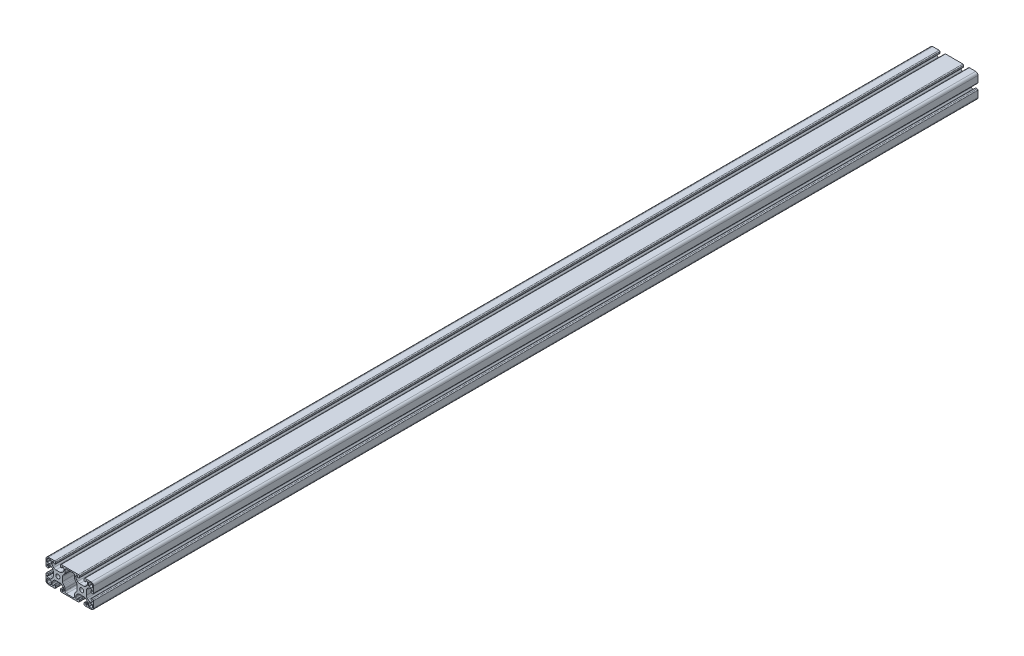
from build123d import *

# Parameters (mm, degrees)
ESQUISSE1_R        = 3.4
BOSS_EXTRU_1_DEPTH = 1487


with BuildPart() as part:
    # Esquisse1 → Boss.-Extru.1 (new body)
    with BuildSketch(Plane.XY.offset(20)):
        with BuildLine():
            Line((66.5, 4.5), (65, 4.5))
            ThreePointArc((65, 4.5), (64.292893219, 4.207106781), (64, 3.5))
            Line((64, 3.5), (64, 1.5))
            ThreePointArc((64, 1.5), (64.439339828, 0.439339828), (65.5, 0))
            Line((65.5, 0), (76, 0))
            ThreePointArc((76, 0), (78.828427125, 1.171572875), (80, 4))
            Line((80, 4), (80, 14.5))
            ThreePointArc((80, 14.5), (79.560660172, 15.560660172), (78.5, 16))
            Line((78.5, 16), (76.5, 16))
            ThreePointArc((76.5, 16), (75.792893219, 15.707106781), (75.5, 15))
            Line((75.5, 15), (75.5, 13.5))
            ThreePointArc((75.5, 13.5), (75.646446609, 13.146446609), (76, 13))
            Line((76, 13), (77.5, 13))
            ThreePointArc((77.5, 13), (77.853553391, 12.853553391), (78, 12.5))
            ThreePointArc((78, 12.5), (77.267766953, 10.732233047), (75.5, 10))
            Line((75.5, 10), (74.192388155, 10))
            ThreePointArc((74.192388155, 10), (72.278970994, 10.380602337), (70.656854249, 11.464466094))
            Line((70.656854249, 11.464466094), (69.214466094, 12.906854249))
            ThreePointArc((69.214466094, 12.906854249), (68.130602337, 14.528970994), (67.75, 16.442388155))
            Line((67.75, 16.442388155), (67.75, 23.557611845))
            ThreePointArc((67.75, 23.557611845), (68.130602337, 25.471029006), (69.214466094, 27.093145751))
            Line((69.214466094, 27.093145751), (70.656854249, 28.535533906))
            ThreePointArc((70.656854249, 28.535533906), (72.278970994, 29.619397663), (74.192388155, 30))
            Line((74.192388155, 30), (75.5, 30))
            ThreePointArc((75.5, 30), (77.267766953, 29.267766953), (78, 27.5))
            ThreePointArc((78, 27.5), (77.853553391, 27.146446609), (77.5, 27))
            Line((77.5, 27), (76, 27))
            ThreePointArc((76, 27), (75.646446609, 26.853553391), (75.5, 26.5))
            Line((75.5, 26.5), (75.5, 25))
            ThreePointArc((75.5, 25), (75.792893219, 24.292893219), (76.5, 24))
            Line((76.5, 24), (78.5, 24))
            ThreePointArc((78.5, 24), (79.560660172, 24.439339828), (80, 25.5))
            Line((80, 25.5), (80, 36))
            ThreePointArc((80, 36), (78.828427125, 38.828427125), (76, 40))
            Line((76, 40), (65.5, 40))
            ThreePointArc((65.5, 40), (64.439339828, 39.560660172), (64, 38.5))
            Line((64, 38.5), (64, 36.5))
            ThreePointArc((64, 36.5), (64.292893219, 35.792893219), (65, 35.5))
            Line((65, 35.5), (66.5, 35.5))
            ThreePointArc((66.5, 35.5), (66.853553391, 35.646446609), (67, 36))
            Line((67, 36), (67, 37.5))
            ThreePointArc((67, 37.5), (67.146446609, 37.853553391), (67.5, 38))
            ThreePointArc((67.5, 38), (69.267766953, 37.267766953), (70, 35.5))
            Line((70, 35.5), (70, 34.192388155))
            ThreePointArc((70, 34.192388155), (69.619397663, 32.278970994), (68.535533906, 30.656854249))
            Line((68.535533906, 30.656854249), (67.093145751, 29.214466094))
            ThreePointArc((67.093145751, 29.214466094), (65.471029006, 28.130602337), (63.557611845, 27.75))
            Line((63.557611845, 27.75), (56.442388155, 27.75))
            ThreePointArc((56.442388155, 27.75), (54.528970994, 28.130602337), (52.906854249, 29.214466094))
            Line((52.906854249, 29.214466094), (51.464466094, 30.656854249))
            ThreePointArc((51.464466094, 30.656854249), (50.380602337, 32.278970994), (50, 34.192388155))
            Line((50, 34.192388155), (50, 35.5))
            ThreePointArc((50, 35.5), (50.732233047, 37.267766953), (52.5, 38))
            ThreePointArc((52.5, 38), (52.853553391, 37.853553391), (53, 37.5))
            Line((53, 37.5), (53, 36))
            ThreePointArc((53, 36), (53.146446609, 35.646446609), (53.5, 35.5))
            Line((53.5, 35.5), (55, 35.5))
            ThreePointArc((55, 35.5), (55.707106781, 35.792893219), (56, 36.5))
            Line((56, 36.5), (56, 38.5))
            ThreePointArc((56, 38.5), (55.560660172, 39.560660172), (54.5, 40))
            Line((54.5, 40), (25.5, 40))
            ThreePointArc((25.5, 40), (24.439339828, 39.560660172), (24, 38.5))
            Line((24, 38.5), (24, 36.5))
            ThreePointArc((24, 36.5), (24.292893219, 35.792893219), (25, 35.5))
            Line((25, 35.5), (26.5, 35.5))
            ThreePointArc((26.5, 35.5), (26.853553391, 35.646446609), (27, 36))
            Line((27, 36), (27, 37.5))
            ThreePointArc((27, 37.5), (27.146446609, 37.853553391), (27.5, 38))
            ThreePointArc((27.5, 38), (29.267766953, 37.267766953), (30, 35.5))
            Line((30, 35.5), (30, 34.192388155))
            ThreePointArc((30, 34.192388155), (29.619397663, 32.278970994), (28.535533906, 30.656854249))
            Line((28.535533906, 30.656854249), (27.093145751, 29.214466094))
            ThreePointArc((27.093145751, 29.214466094), (25.471029006, 28.130602337), (23.557611845, 27.75))
            Line((23.557611845, 27.75), (16.442388155, 27.75))
            ThreePointArc((16.442388155, 27.75), (14.528970994, 28.130602337), (12.906854249, 29.214466094))
            Line((12.906854249, 29.214466094), (11.464466094, 30.656854249))
            ThreePointArc((11.464466094, 30.656854249), (10.380602337, 32.278970994), (10, 34.192388155))
            Line((10, 34.192388155), (10, 35.5))
            ThreePointArc((10, 35.5), (10.732233047, 37.267766953), (12.5, 38))
            ThreePointArc((12.5, 38), (12.853553391, 37.853553391), (13, 37.5))
            Line((13, 37.5), (13, 36))
            ThreePointArc((13, 36), (13.146446609, 35.646446609), (13.5, 35.5))
            Line((13.5, 35.5), (15, 35.5))
            ThreePointArc((15, 35.5), (15.707106781, 35.792893219), (16, 36.5))
            Line((16, 36.5), (16, 38.5))
            ThreePointArc((16, 38.5), (15.560660172, 39.560660172), (14.5, 40))
            Line((14.5, 40), (4, 40))
            ThreePointArc((4, 40), (1.171572875, 38.828427125), (0, 36))
            Line((0, 36), (0, 25.5))
            ThreePointArc((0, 25.5), (0.439339828, 24.439339828), (1.5, 24))
            Line((1.5, 24), (3.5, 24))
            ThreePointArc((3.5, 24), (4.207106781, 24.292893219), (4.5, 25))
            Line((4.5, 25), (4.5, 26.5))
            ThreePointArc((4.5, 26.5), (4.353553391, 26.853553391), (4, 27))
            Line((4, 27), (2.5, 27))
            ThreePointArc((2.5, 27), (2.146446609, 27.146446609), (2, 27.5))
            ThreePointArc((2, 27.5), (2.732233047, 29.267766953), (4.5, 30))
            Line((4.5, 30), (5.807611845, 30))
            ThreePointArc((5.807611845, 30), (7.721029006, 29.619397663), (9.343145751, 28.535533906))
            Line((9.343145751, 28.535533906), (10.785533906, 27.093145751))
            ThreePointArc((10.785533906, 27.093145751), (11.869397663, 25.471029006), (12.25, 23.557611845))
            Line((12.25, 23.557611845), (12.25, 16.442388155))
            ThreePointArc((12.25, 16.442388155), (11.869397663, 14.528970994), (10.785533906, 12.906854249))
            Line((10.785533906, 12.906854249), (9.343145751, 11.464466094))
            ThreePointArc((9.343145751, 11.464466094), (7.721029006, 10.380602337), (5.807611845, 10))
            Line((5.807611845, 10), (4.5, 10))
            ThreePointArc((4.5, 10), (2.732233047, 10.732233047), (2, 12.5))
            ThreePointArc((2, 12.5), (2.146446609, 12.853553391), (2.5, 13))
            Line((2.5, 13), (4, 13))
            ThreePointArc((4, 13), (4.353553391, 13.146446609), (4.5, 13.5))
            Line((4.5, 13.5), (4.5, 15))
            ThreePointArc((4.5, 15), (4.207106781, 15.707106781), (3.5, 16))
            Line((3.5, 16), (1.5, 16))
            ThreePointArc((1.5, 16), (0.439339828, 15.560660172), (0, 14.5))
            Line((0, 14.5), (0, 4))
            ThreePointArc((0, 4), (1.171572875, 1.171572875), (4, 0))
            Line((4, 0), (14.5, 0))
            ThreePointArc((14.5, 0), (15.560660172, 0.439339828), (16, 1.5))
            Line((16, 1.5), (16, 3.5))
            ThreePointArc((16, 3.5), (15.707106781, 4.207106781), (15, 4.5))
            Line((15, 4.5), (13.5, 4.5))
            ThreePointArc((13.5, 4.5), (13.146446609, 4.353553391), (13, 4))
            Line((13, 4), (13, 2.5))
            ThreePointArc((13, 2.5), (12.853553391, 2.146446609), (12.5, 2))
            ThreePointArc((12.5, 2), (10.732233047, 2.732233047), (10, 4.5))
            Line((10, 4.5), (10, 5.807611845))
            ThreePointArc((10, 5.807611845), (10.380602337, 7.721029006), (11.464466094, 9.343145751))
            Line((11.464466094, 9.343145751), (12.906854249, 10.785533906))
            ThreePointArc((12.906854249, 10.785533906), (14.528970994, 11.869397663), (16.442388155, 12.25))
            Line((16.442388155, 12.25), (23.557611845, 12.25))
            ThreePointArc((23.557611845, 12.25), (25.471029006, 11.869397663), (27.093145751, 10.785533906))
            Line((27.093145751, 10.785533906), (28.535533906, 9.343145751))
            ThreePointArc((28.535533906, 9.343145751), (29.619397663, 7.721029006), (30, 5.807611845))
            Line((30, 5.807611845), (30, 4.5))
            ThreePointArc((30, 4.5), (29.267766953, 2.732233047), (27.5, 2))
            ThreePointArc((27.5, 2), (27.146446609, 2.146446609), (27, 2.5))
            Line((27, 2.5), (27, 4))
            ThreePointArc((27, 4), (26.853553391, 4.353553391), (26.5, 4.5))
            Line((26.5, 4.5), (25, 4.5))
            ThreePointArc((25, 4.5), (24.292893219, 4.207106781), (24, 3.5))
            Line((24, 3.5), (24, 1.5))
            ThreePointArc((24, 1.5), (24.439339828, 0.439339828), (25.5, 0))
            Line((25.5, 0), (54.5, 0))
            ThreePointArc((54.5, 0), (55.560660172, 0.439339828), (56, 1.5))
            Line((56, 1.5), (56, 3.5))
            ThreePointArc((56, 3.5), (55.707106781, 4.207106781), (55, 4.5))
            Line((55, 4.5), (53.5, 4.5))
            ThreePointArc((53.5, 4.5), (53.146446609, 4.353553391), (53, 4))
            Line((53, 4), (53, 2.5))
            ThreePointArc((53, 2.5), (52.853553391, 2.146446609), (52.5, 2))
            ThreePointArc((52.5, 2), (50.732233047, 2.732233047), (50, 4.5))
            Line((50, 4.5), (50, 5.807611845))
            ThreePointArc((50, 5.807611845), (50.380602337, 7.721029006), (51.464466094, 9.343145751))
            Line((51.464466094, 9.343145751), (52.906854249, 10.785533906))
            ThreePointArc((52.906854249, 10.785533906), (54.528970994, 11.869397663), (56.442388155, 12.25))
            Line((56.442388155, 12.25), (63.557611845, 12.25))
            ThreePointArc((63.557611845, 12.25), (65.471029006, 11.869397663), (67.093145751, 10.785533906))
            Line((67.093145751, 10.785533906), (68.535533906, 9.343145751))
            ThreePointArc((68.535533906, 9.343145751), (69.619397663, 7.721029006), (70, 5.807611845))
            Line((70, 5.807611845), (70, 4.5))
            ThreePointArc((70, 4.5), (69.267766953, 2.732233047), (67.5, 2))
            ThreePointArc((67.5, 2), (67.146446609, 2.146446609), (67, 2.5))
            Line((67, 2.5), (67, 4))
            ThreePointArc((67, 4), (66.853553391, 4.353553391), (66.5, 4.5))
        make_face()
        with Locations(Location((20, 20, 0), (0, 0, 180))):
            Circle(ESQUISSE1_R, mode=Mode.SUBTRACT)
        with Locations(Location((60, 20, 0), (0, 0, 180))):
            Circle(ESQUISSE1_R, mode=Mode.SUBTRACT)
        with BuildLine():
            Line((31.8, 4.5), (31.8, 8.250252532))
            ThreePointArc((31.8, 8.250252532), (31.419397663, 10.163669694), (30.335533906, 11.785786438))
            Line((30.335533906, 11.785786438), (29.214466094, 12.906854249))
            ThreePointArc((29.214466094, 12.906854249), (28.130602337, 14.528970994), (27.75, 16.442388155))
            Line((27.75, 16.442388155), (27.75, 23.557611845))
            ThreePointArc((27.75, 23.557611845), (28.130602337, 25.471029006), (29.214466094, 27.093145751))
            Line((29.214466094, 27.093145751), (30.335533906, 28.214213562))
            ThreePointArc((30.335533906, 28.214213562), (31.419397663, 29.836330306), (31.8, 31.749747468))
            Line((31.8, 31.749747468), (31.8, 35.5))
            ThreePointArc((31.8, 35.5), (32.532233047, 37.267766953), (34.3, 38))
            Line((34.3, 38), (45.7, 38))
            ThreePointArc((45.7, 38), (47.467766953, 37.267766953), (48.2, 35.5))
            Line((48.2, 35.5), (48.2, 31.749747468))
            ThreePointArc((48.2, 31.749747468), (48.580602337, 29.836330306), (49.664466094, 28.214213562))
            Line((49.664466094, 28.214213562), (50.785533906, 27.093145751))
            ThreePointArc((50.785533906, 27.093145751), (51.869397663, 25.471029006), (52.25, 23.557611845))
            Line((52.25, 23.557611845), (52.25, 16.442388155))
            ThreePointArc((52.25, 16.442388155), (51.869397663, 14.528970994), (50.785533906, 12.906854249))
            Line((50.785533906, 12.906854249), (49.664466094, 11.785786438))
            ThreePointArc((49.664466094, 11.785786438), (48.580602337, 10.163669694), (48.2, 8.250252532))
            Line((48.2, 8.250252532), (48.2, 4.5))
            ThreePointArc((48.2, 4.5), (47.467766953, 2.732233047), (45.7, 2))
            Line((45.7, 2), (34.3, 2))
            ThreePointArc((34.3, 2), (32.532233047, 2.732233047), (31.8, 4.5))
        make_face(mode=Mode.SUBTRACT)
        with BuildLine():
            Line((7.7, 1.8), (4, 1.8))
            ThreePointArc((4, 1.8), (2.444365081, 2.444365081), (1.8, 4))
            Line((1.8, 4), (1.8, 7.7))
            ThreePointArc((1.8, 7.7), (1.946446609, 8.053553391), (2.3, 8.2))
            Line((2.3, 8.2), (7.7, 8.2))
            ThreePointArc((7.7, 8.2), (8.053553391, 8.053553391), (8.2, 7.7))
            Line((8.2, 7.7), (8.2, 2.3))
            ThreePointArc((8.2, 2.3), (8.053553391, 1.946446609), (7.7, 1.8))
        make_face(mode=Mode.SUBTRACT)
        with BuildLine():
            Line((72.3, 38.2), (76, 38.2))
            ThreePointArc((76, 38.2), (77.555634919, 37.555634919), (78.2, 36))
            Line((78.2, 36), (78.2, 32.3))
            ThreePointArc((78.2, 32.3), (78.053553391, 31.946446609), (77.7, 31.8))
            Line((77.7, 31.8), (72.3, 31.8))
            ThreePointArc((72.3, 31.8), (71.946446609, 31.946446609), (71.8, 32.3))
            Line((71.8, 32.3), (71.8, 37.7))
            ThreePointArc((71.8, 37.7), (71.946446609, 38.053553391), (72.3, 38.2))
        make_face(mode=Mode.SUBTRACT)
        with BuildLine():
            Line((78.2, 7.7), (78.2, 4))
            ThreePointArc((78.2, 4), (77.555634919, 2.444365081), (76, 1.8))
            Line((76, 1.8), (72.3, 1.8))
            ThreePointArc((72.3, 1.8), (71.946446609, 1.946446609), (71.8, 2.3))
            Line((71.8, 2.3), (71.8, 7.7))
            ThreePointArc((71.8, 7.7), (71.946446609, 8.053553391), (72.3, 8.2))
            Line((72.3, 8.2), (77.7, 8.2))
            ThreePointArc((77.7, 8.2), (78.053553391, 8.053553391), (78.2, 7.7))
        make_face(mode=Mode.SUBTRACT)
        with BuildLine():
            Line((1.8, 32.3), (1.8, 36))
            ThreePointArc((1.8, 36), (2.444365081, 37.555634919), (4, 38.2))
            Line((4, 38.2), (7.7, 38.2))
            ThreePointArc((7.7, 38.2), (8.053553391, 38.053553391), (8.2, 37.7))
            Line((8.2, 37.7), (8.2, 32.3))
            ThreePointArc((8.2, 32.3), (8.053553391, 31.946446609), (7.7, 31.8))
            Line((7.7, 31.8), (2.3, 31.8))
            ThreePointArc((2.3, 31.8), (1.946446609, 31.946446609), (1.8, 32.3))
        make_face(mode=Mode.SUBTRACT)
    extrude(amount=-BOSS_EXTRU_1_DEPTH)


solid = part.part
